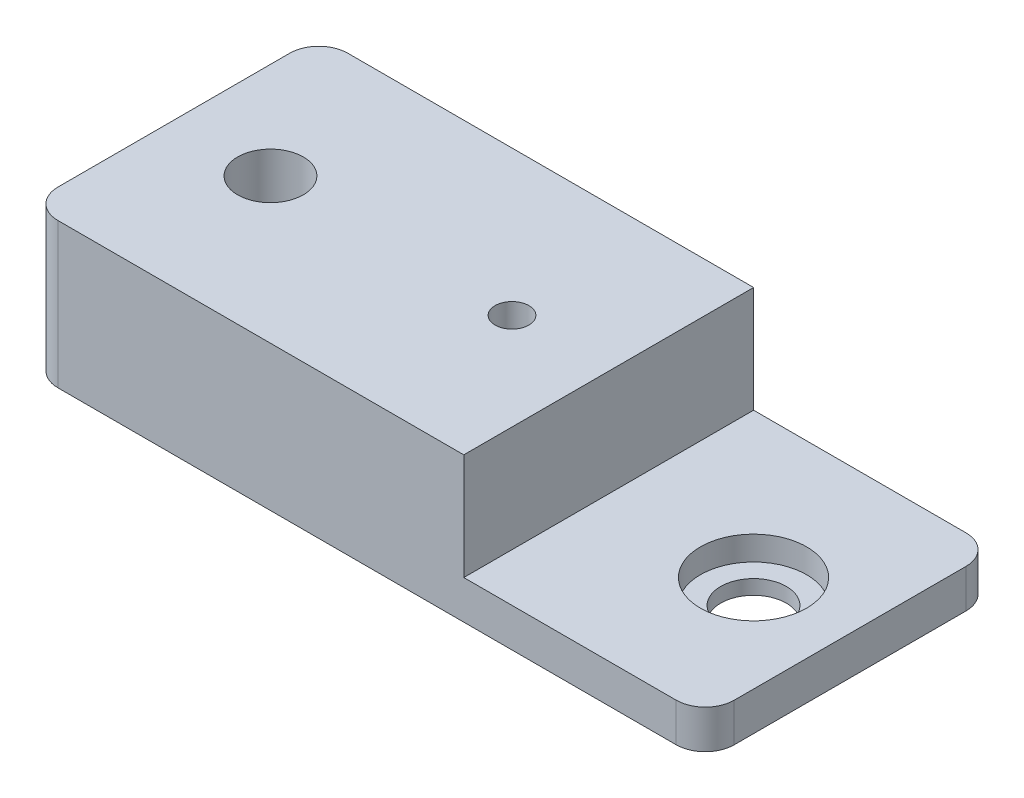
from build123d import *

# Parameters (mm, degrees)
SKETCH_1_W          = 70
SKETCH_1_H          = 30
EXTRUDE_1_DEPTH     = 15
FILLET_1_R          = 3
SKETCH_5_R          = 1.75
SKETCH_5_R_2        = 3.4
CUT_EXTRUDE_1_DEPTH = 41.926763859
CUT_EXTRUDE_2_DEPTH = 7.8
SKETCH_7_W          = 30.080931192
SKETCH_7_H          = 35.934517801
CUT_EXTRUDE_4_DEPTH = 11
SKETCH_9_R          = 5.5
CUT_EXTRUDE_5_DEPTH = 2.5


with BuildPart() as part:
    # 草图1 → 凸台-拉伸1 (new body)
    with BuildSketch(Plane(origin=(0, 0, 0), x_dir=(1, 0, 0), z_dir=(0, 1, 0))):
        Rectangle(SKETCH_1_W, SKETCH_1_H)
    extrude(amount=EXTRUDE_1_DEPTH)

    # 圆角1
    fillet_1_edges = [part.edges().sort_by_distance(p)[0] for p in [
        (35, 7.5, 15),
        (-35, 7.5, 15),
        (-35, 7.5, -15),
        (35, 7.5, -15),
    ]]
    fillet(fillet_1_edges, radius=FILLET_1_R)

    # 草图5 → 切除-拉伸1 (cut, through all)
    with BuildSketch(Plane(origin=(0, 15, 0), x_dir=(1, 0, 0), z_dir=(0, 1, 0))):
        with Locations(Location((0, 0, 0), (0, 0, 270))):
            Circle(SKETCH_5_R)
        with Locations(Location((-25, 0, 0), (0, 0, 270))):
            Circle(SKETCH_5_R_2)
        with Locations(Location((25, 0, 0), (0, 0, 270))):
            Circle(SKETCH_5_R_2)
    extrude(amount=-CUT_EXTRUDE_1_DEPTH, mode=Mode.SUBTRACT)

    # 草图6 → 切除-拉伸2 (cut)
    with BuildSketch(Plane.XZ):
        Polygon((0, 3.579571669), (-3.1, 1.789785834), (-3.1, -1.789785834), (0, -3.579571669), (3.1, -1.789785834), (3.1, 1.789785834), align=None)
    extrude(amount=-CUT_EXTRUDE_2_DEPTH, mode=Mode.SUBTRACT)

    # 草图7 → 切除-拉伸4 (cut)
    with BuildSketch(Plane(origin=(0, 15, 0), x_dir=(1, 0, 0), z_dir=(0, 1, 0))):
        with Locations((25.049156013, -1.117442304)):
            Rectangle(SKETCH_7_W, SKETCH_7_H)
    extrude(amount=-CUT_EXTRUDE_4_DEPTH, mode=Mode.SUBTRACT)

    # 草图9 → 切除-拉伸5 (cut)
    with BuildSketch(Plane(origin=(0, 4, 0), x_dir=(1, 0, 0), z_dir=(0, 1, 0))):
        with Locations(Location((25, 0, 0), (0, 0, 270))):
            Circle(SKETCH_9_R)
    extrude(amount=-CUT_EXTRUDE_5_DEPTH, mode=Mode.SUBTRACT)


solid = part.part
